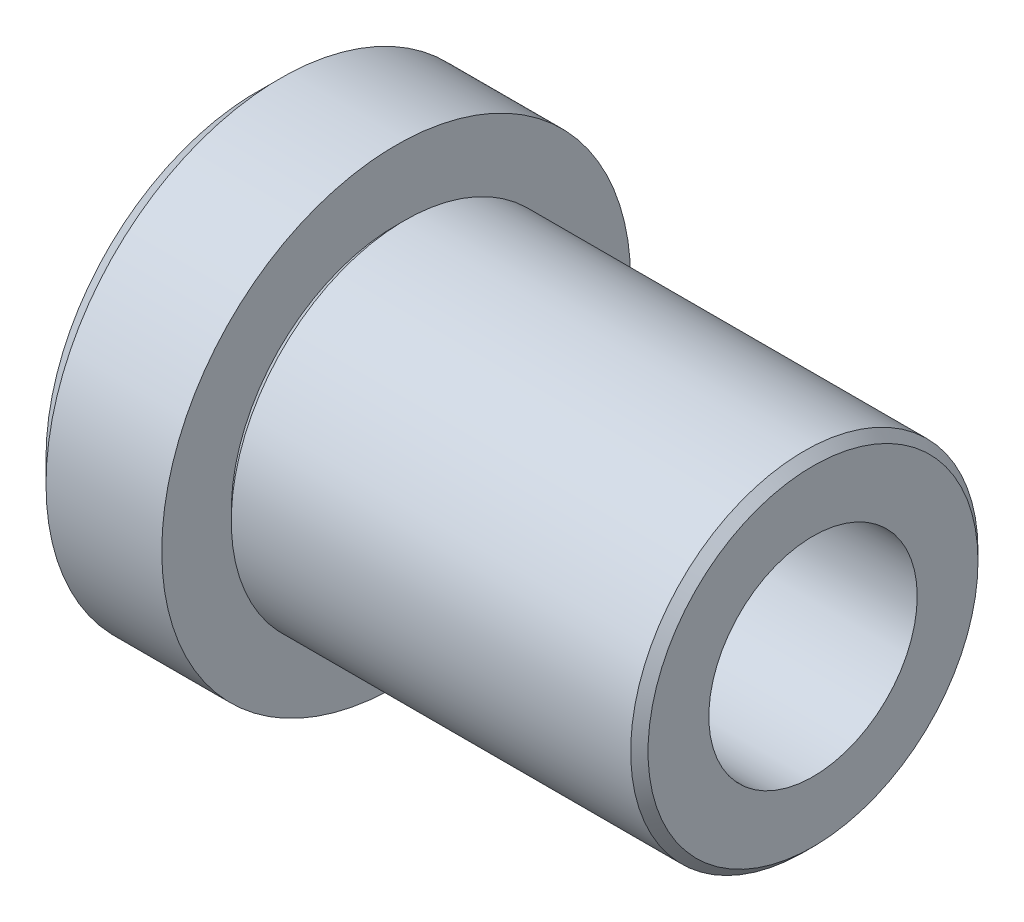
from build123d import *


with BuildPart() as part:
    # Sketch3 → Revolve1 (revolve)
    with BuildSketch(Plane.XY, mode=Mode.PRIVATE) as revolve1_sk:
        Polygon((6.35, 2.38125), (6.35, 3.7703125), (6.1515625, 3.96875), (-2.9765625, 3.96875), (-3.175, 3.7703125), (-3.175, 5.3578125), (-5.820833333, 5.3578125), (-6.35, 4.828645833), (-6.35, 2.910416667), (-5.820833333, 2.38125), align=None)
    revolve(revolve1_sk.sketch.rotate(Axis((6.35, 0, 0), (-1, 0, 0)), 90), axis=Axis((6.35, 0, 0), (-1, 0, 0)))


solid = part.part
